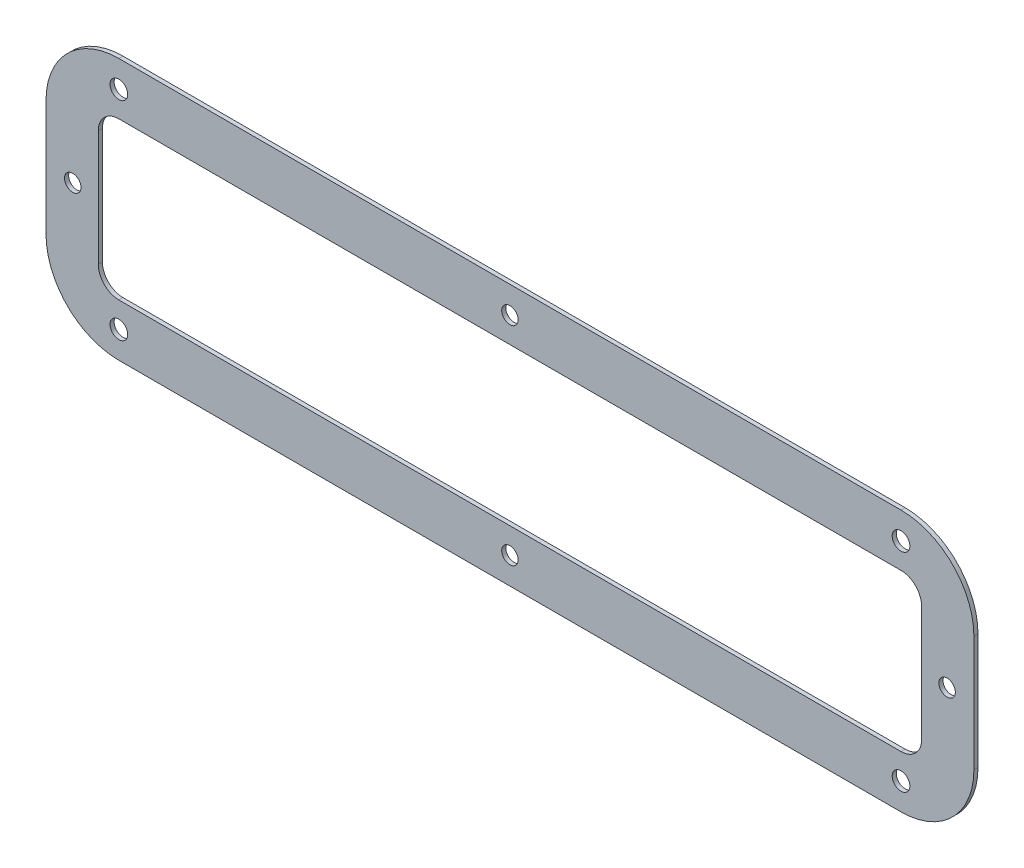
from build123d import *

# Parameters (mm, degrees)
ESQUISSE1_R        = 2
ESQUISSE1_R_2      = 2.146897886
BOSS_EXTRU_1_DEPTH = 1


with BuildPart() as part:
    # Esquisse1 → Boss.-Extru.1 (new body)
    with BuildSketch(Plane.XY):
        with BuildLine():
            Line((-95, -31.75), (95, -31.75))
            ThreePointArc((95, -31.75), (107.515790027, -26.565790027), (112.7, -14.05))
            Line((112.7, -14.05), (112.7, 14.05))
            ThreePointArc((112.7, 14.05), (107.515790027, 26.565790027), (95, 31.75))
            Line((95, 31.75), (-95, 31.75))
            ThreePointArc((-95, 31.75), (-107.515790027, 26.565790027), (-112.7, 14.05))
            Line((-112.7, 14.05), (-112.7, -14.05))
            ThreePointArc((-112.7, -14.05), (-107.515790027, -26.565790027), (-95, -31.75))
        make_face()
        with Locations((-106.2, 0)):
            Circle(ESQUISSE1_R, mode=Mode.SUBTRACT)
        with Locations((0, 25.25)):
            Circle(ESQUISSE1_R, mode=Mode.SUBTRACT)
        with Locations((-95, 25.25)):
            Circle(ESQUISSE1_R_2, mode=Mode.SUBTRACT)
        with Locations(Location((-95, -25.25, 0), (0, 0, 180))):
            Circle(ESQUISSE1_R_2, mode=Mode.SUBTRACT)
        with Locations(Location((0, -25.25, 0), (0, 0, 180))):
            Circle(ESQUISSE1_R, mode=Mode.SUBTRACT)
        with Locations((95, -25.25)):
            Circle(ESQUISSE1_R_2, mode=Mode.SUBTRACT)
        with Locations(Location((106.2, 0, 0), (0, 0, 180))):
            Circle(ESQUISSE1_R, mode=Mode.SUBTRACT)
        with Locations(Location((95, 25.25, 0), (0, 0, 180))):
            Circle(ESQUISSE1_R_2, mode=Mode.SUBTRACT)
        with BuildLine():
            Line((-95, -19.05), (95, -19.05))
            ThreePointArc((95, -19.05), (98.535533906, -17.585533906), (100, -14.05))
            Line((100, -14.05), (100, 14.05))
            ThreePointArc((100, 14.05), (98.535533906, 17.585533906), (95, 19.05))
            Line((95, 19.05), (-95, 19.05))
            ThreePointArc((-95, 19.05), (-98.535533906, 17.585533906), (-100, 14.05))
            Line((-100, 14.05), (-100, -14.05))
            ThreePointArc((-100, -14.05), (-98.535533906, -17.585533906), (-95, -19.05))
        make_face(mode=Mode.SUBTRACT)
    extrude(amount=BOSS_EXTRU_1_DEPTH)


solid = part.part
